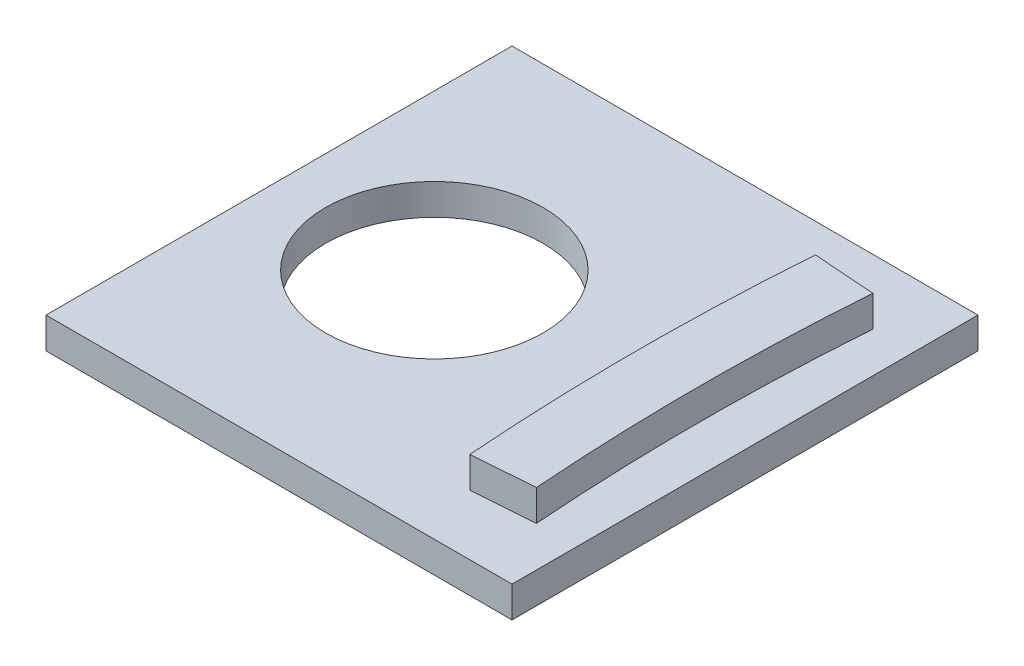
from build123d import *

# Parameters (mm, degrees)
SKETCH1_W           = 150
SKETCH1_H           = 150
SKETCH1_R           = 35
BOSS_EXTRUDE1_DEPTH = 10
BOSS_EXTRUDE2_DEPTH = 10


with BuildPart() as part:
    # Sketch1 → Boss-Extrude1 (new body)
    with BuildSketch(Plane(origin=(0, 0, 0), x_dir=(1, 0, 0), z_dir=(0, 1, 0))):
        with Locations((75, -75)):
            Rectangle(SKETCH1_W, SKETCH1_H)
        with Locations(Location((50, -75, 0), (0, 0, 270))):
            Circle(SKETCH1_R, mode=Mode.SUBTRACT)
    extrude(amount=BOSS_EXTRUDE1_DEPTH)

    # Sketch7 → Boss-Extrude2 (add)
    with BuildSketch(Plane(origin=(0, 10, 0), x_dir=(1, 0, 0), z_dir=(0, 1, 0))):
        with BuildLine():
            Line((117.065640108, -19.374526579), (137.010556372, -20.857872537))
            ThreePointArc((137.010556372, -20.857872537), (135, -75), (137.010556372, -129.142127463))
            Line((137.010556372, -129.142127463), (117.065640108, -130.625473421))
            ThreePointArc((117.065640108, -130.625473421), (115, -75), (117.065640108, -19.374526579))
        make_face()
    extrude(amount=BOSS_EXTRUDE2_DEPTH)


solid = part.part
